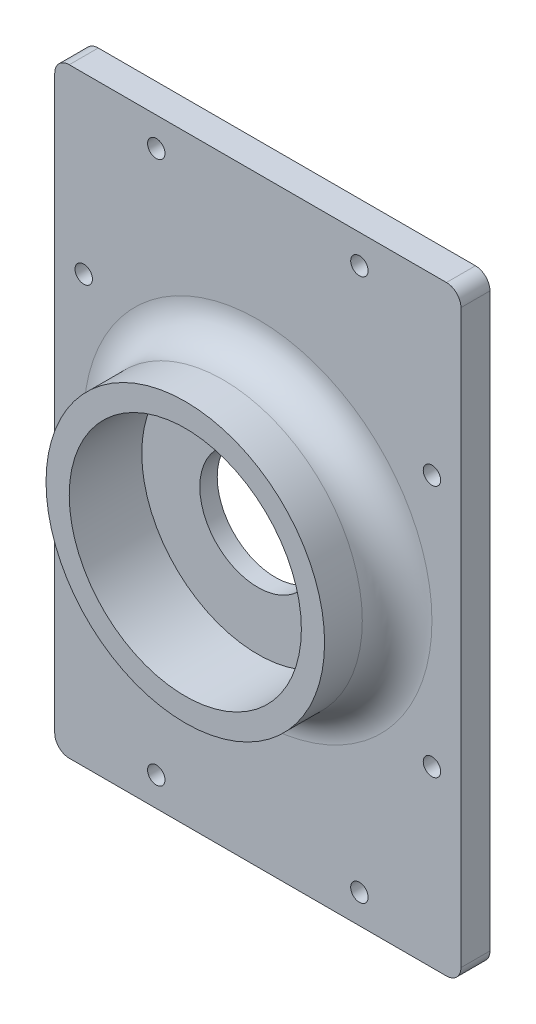
from build123d import *

# Parameters (mm, degrees)
SKETCH1_W           = 140
SKETCH1_H           = 207
SKETCH1_R           = 3
BOSS_EXTRUDE1_DEPTH = 10
SKETCH2_R           = 48
SKETCH2_R_2         = 40
BOSS_EXTRUDE2_DEPTH = 25
SKETCH3_R           = 20
CUT_EXTRUDE1_DEPTH  = 25
FILLET1_R           = 5
SKETCH4_R           = 30
CUT_EXTRUDE2_DEPTH  = 4
FILLET2_R           = 12


with BuildPart() as part:
    # Sketch1 → Boss-Extrude1 (new body)
    with BuildSketch(Plane.XY):
        Rectangle(SKETCH1_W, SKETCH1_H)
        with Locations((-35, 93.5)):
            Circle(SKETCH1_R, mode=Mode.SUBTRACT)
        with Locations((35, 93.5)):
            Circle(SKETCH1_R, mode=Mode.SUBTRACT)
        with Locations(Location((35, -93.5, 0), (0, 0, 180))):
            Circle(SKETCH1_R, mode=Mode.SUBTRACT)
        with Locations(Location((-35, -93.5, 0), (0, 0, 180))):
            Circle(SKETCH1_R, mode=Mode.SUBTRACT)
        with Locations((-60, -43.5)):
            Circle(SKETCH1_R, mode=Mode.SUBTRACT)
        with Locations((-60, 43.5)):
            Circle(SKETCH1_R, mode=Mode.SUBTRACT)
        with Locations(Location((60, 43.5, 0), (0, 0, 180))):
            Circle(SKETCH1_R, mode=Mode.SUBTRACT)
        with Locations(Location((60, -43.5, 0), (0, 0, 180))):
            Circle(SKETCH1_R, mode=Mode.SUBTRACT)
    extrude(amount=BOSS_EXTRUDE1_DEPTH)

    # Sketch2 → Boss-Extrude2 (add)
    with BuildSketch(Plane.XY.offset(10)):
        with Locations(Location((0, 0, 0), (0, 0, 180))):
            Circle(SKETCH2_R)
        with Locations(Location((0, 0, 0), (0, 0, 180))):
            Circle(SKETCH2_R_2, mode=Mode.SUBTRACT)
    extrude(amount=BOSS_EXTRUDE2_DEPTH)

    # Sketch3 → Cut-Extrude1 (cut)
    with BuildSketch(Plane.XY.offset(10)):
        with Locations(Location((0, 0, 0), (0, 0, 180))):
            Circle(SKETCH3_R)
    extrude(amount=-CUT_EXTRUDE1_DEPTH, mode=Mode.SUBTRACT)

    # Fillet1
    fillet1_edges = [part.edges().sort_by_distance(p)[0] for p in [
        (70, -103.5, 5),
        (-70, -103.5, 5),
        (-70, 103.5, 5),
        (70, 103.5, 5),
    ]]
    fillet(fillet1_edges, radius=FILLET1_R)

    # Sketch4 → Cut-Extrude2 (cut)
    with BuildSketch(Plane(origin=(0, 0, 0), x_dir=(-1, 0, 0), z_dir=(0, 0, -1))):
        Circle(SKETCH4_R)
    extrude(amount=-CUT_EXTRUDE2_DEPTH, mode=Mode.SUBTRACT)

    # Fillet2
    fillet2_edges = [part.edges().sort_by_distance(p)[0] for p in [
        (48, 0, 10),
    ]]
    fillet(fillet2_edges, radius=FILLET2_R)


solid = part.part
